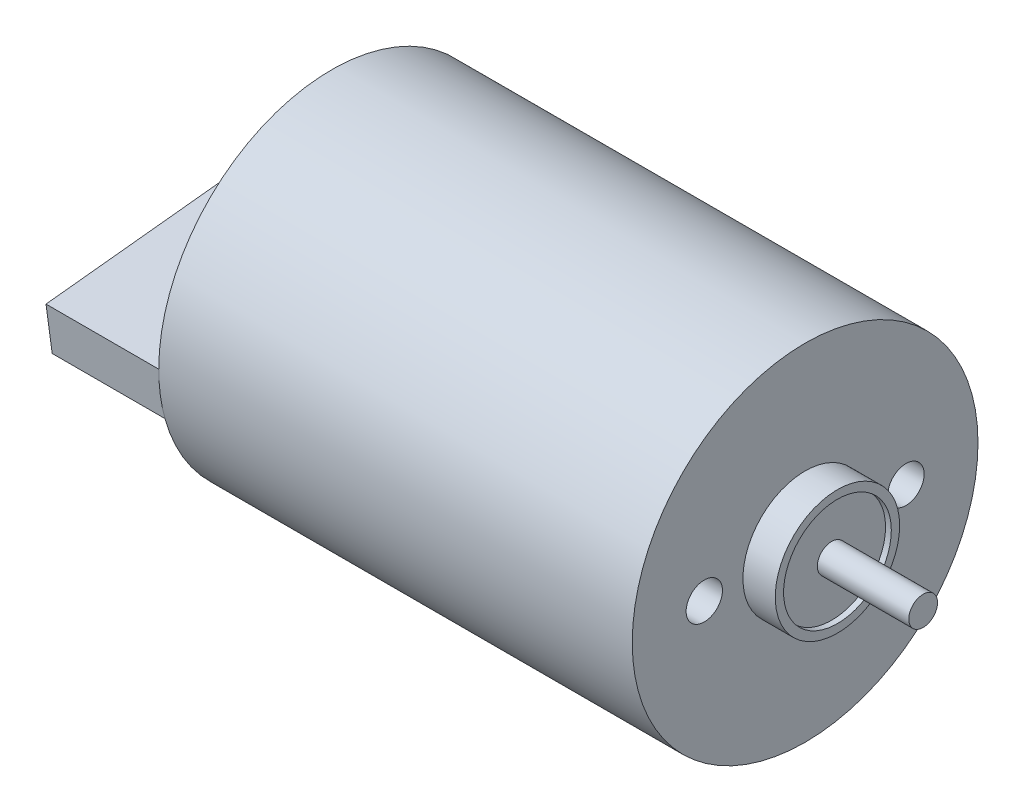
from build123d import *

# Parameters (mm, degrees)
SKETCH1_R                  = 13.8
BOSS_EXTRUDE1_DEPTH        = 37.8
SKETCH2_R                  = 4.965
BOSS_EXTRUDE2_DEPTH        = 2.58
SKETCH3_R                  = 4.3
CUT_EXTRUDE1_DEPTH         = 0.46
SKETCH4_R                  = 1.15
BOSS_EXTRUDE3_DEPTH        = 7.3
M2_5_CLEARANCE_HOLE1_D     = 2.9
M2_5_CLEARANCE_HOLE1_DEPTH = 10
M2_5_CLEARANCE_HOLE1_TIP   = 0.871247898
BOSS_EXTRUDE4_DEPTH        = 9


with BuildPart() as part:
    # Sketch1 → Boss-Extrude1 (new body)
    with BuildSketch(Plane(origin=(0, 0, 0), x_dir=(0, 0, -1), z_dir=(1, 0, 0))):
        Circle(SKETCH1_R)
    extrude(amount=BOSS_EXTRUDE1_DEPTH)

    # Sketch2 → Boss-Extrude2 (add)
    with BuildSketch(Plane(origin=(37.8, 0, 0), x_dir=(0, 0, -1), z_dir=(1, 0, 0))):
        Circle(SKETCH2_R)
    extrude(amount=BOSS_EXTRUDE2_DEPTH)

    # Sketch3 → Cut-Extrude1 (cut)
    with BuildSketch(Plane(origin=(40.38, 0, 0), x_dir=(0, 0, -1), z_dir=(1, 0, 0))):
        Circle(SKETCH3_R)
    extrude(amount=-CUT_EXTRUDE1_DEPTH, mode=Mode.SUBTRACT)

    # Sketch4 → Boss-Extrude3 (add)
    with BuildSketch(Plane(origin=(39.92, 0, 0), x_dir=(0, 0, -1), z_dir=(1, 0, 0))):
        Circle(SKETCH4_R)
    extrude(amount=BOSS_EXTRUDE3_DEPTH)

    # M2.5 Clearance Hole1
    with Locations(Plane(origin=(37.8, 0, 0), x_dir=(0, 0, -1), z_dir=(1, 0, 0))):
        with Locations((-8.05, 0), (8.05, 0)):
            Hole(M2_5_CLEARANCE_HOLE1_D / 2, depth=M2_5_CLEARANCE_HOLE1_DEPTH)
            with Locations((0, 0, -(M2_5_CLEARANCE_HOLE1_DEPTH + M2_5_CLEARANCE_HOLE1_TIP / 2))):  # 118° drill point
                Cone(0, M2_5_CLEARANCE_HOLE1_D / 2, M2_5_CLEARANCE_HOLE1_TIP, mode=Mode.SUBTRACT)

    # Sketch7 → Boss-Extrude4 (add)
    with BuildSketch(Plane.ZY):
        Polygon((-13.48707523, 2.922122814), (13.8, 0), (13.303912233, -3.666867776), (-12.668048772, -5.47362223), align=None)
    extrude(amount=BOSS_EXTRUDE4_DEPTH)


solid = part.part
